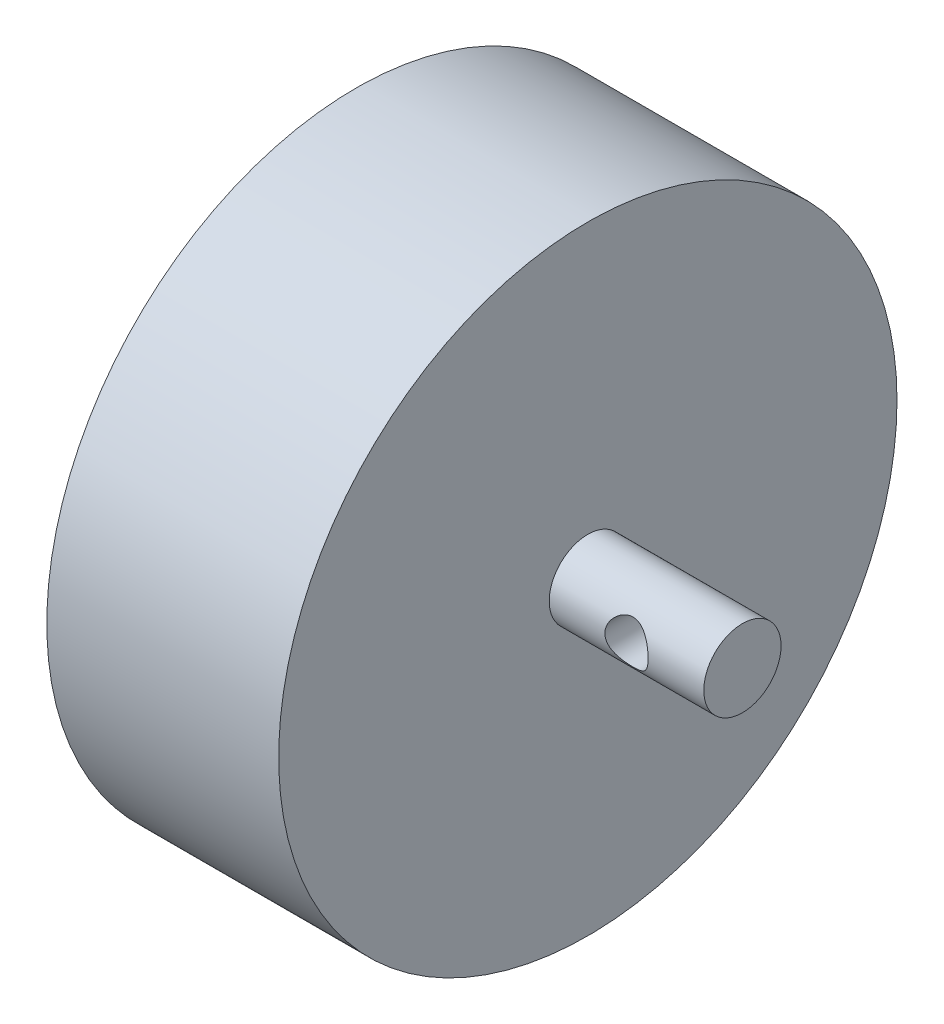
from build123d import *

# Parameters (mm, degrees)
SKETCH_1_R               = 3.5
EXTRUDE_1_DEPTH          = 3
SKETCH_2_R               = 20
EXTRUDE_2_DEPTH          = 15
SKETCH_3_R               = 2.5
EXTRUDE_3_DEPTH          = 10
CUT_EXTRUDE_1_DEPTH      = 10
CUT_EXTRUDE_1_DEPTH_BACK = 10
SKETCH_4_R               = 1.4
HOLE_WIZARD_M3_1_D       = 2.5
HOLE_WIZARD_M3_1_DEPTH   = 6.748924226
HOLE_WIZARD_M3_1_TIP     = 0.751075774


with BuildPart() as part:
    # 草图1 → 凸台-拉伸1 (new body)
    with BuildSketch(Plane(origin=(0, 0, 0), x_dir=(0, 0, -1), z_dir=(1, 0, 0))):
        Circle(SKETCH_1_R)
    extrude(amount=EXTRUDE_1_DEPTH)

    # 草图2 → 凸台-拉伸2 (add)
    with BuildSketch(Plane(origin=(3, 0, 0), x_dir=(0, 0, -1), z_dir=(1, 0, 0))):
        Circle(SKETCH_2_R)
    extrude(amount=EXTRUDE_2_DEPTH)

    # 草图3 → 凸台-拉伸3 (add)
    with BuildSketch(Plane(origin=(18, 0, 0), x_dir=(0, 0, -1), z_dir=(1, 0, 0))):
        Circle(SKETCH_3_R)
    extrude(amount=EXTRUDE_3_DEPTH)

    # 草图4 → 切除-拉伸1 (cut, two sides: drawn at the far end of the back side and taken through both)
    with BuildSketch(Plane.XY.offset(-CUT_EXTRUDE_1_DEPTH_BACK)):
        with Locations((23, 0)):
            Circle(SKETCH_4_R)
    extrude(amount=CUT_EXTRUDE_1_DEPTH + CUT_EXTRUDE_1_DEPTH_BACK, mode=Mode.SUBTRACT)

    # M3 螺纹孔1
    with Locations(Plane(origin=(3, 0, 6.5), x_dir=(0, 0, -1), z_dir=(-1, 0, 0))):
        with Locations((0, 0), (6.5, 6.5), (13, 0), (6.5, -6.5)):
            Hole(HOLE_WIZARD_M3_1_D / 2, depth=HOLE_WIZARD_M3_1_DEPTH)
            with Locations((0, 0, -(HOLE_WIZARD_M3_1_DEPTH + HOLE_WIZARD_M3_1_TIP / 2))):  # 118° drill point
                Cone(0, HOLE_WIZARD_M3_1_D / 2, HOLE_WIZARD_M3_1_TIP, mode=Mode.SUBTRACT)


solid = part.part
